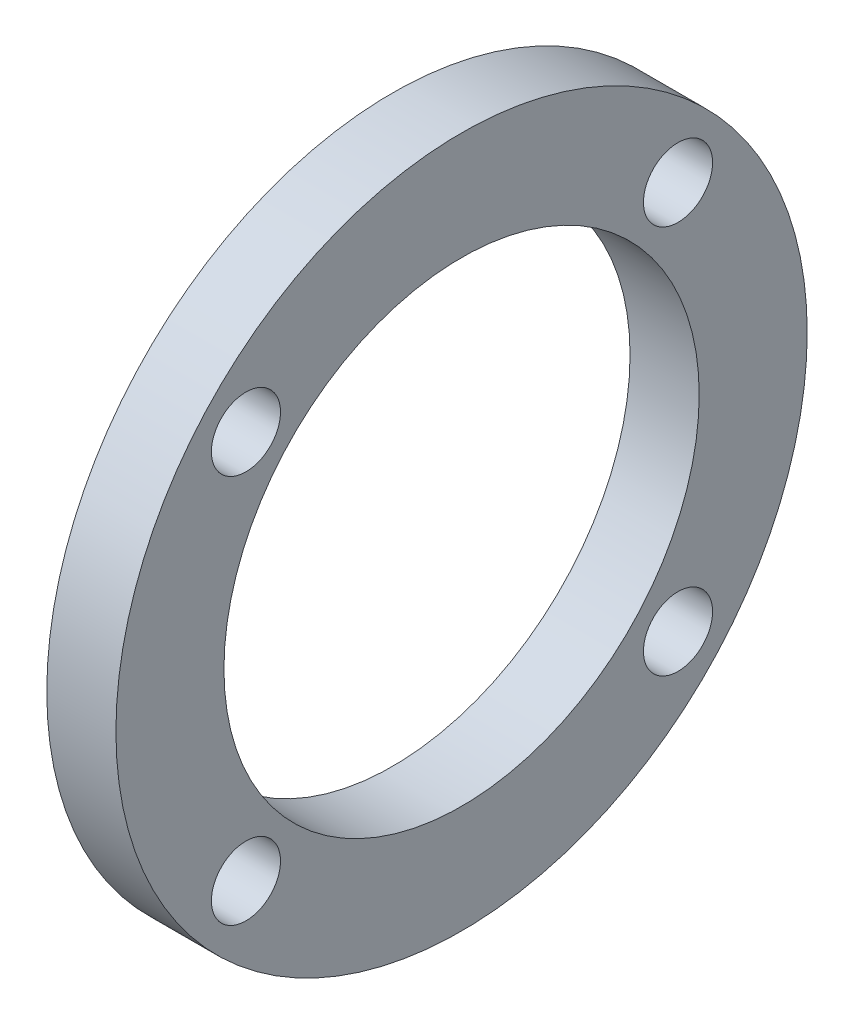
from build123d import *

# Parameters (mm, degrees)
SKETCH1_R           = 40
BOSS_EXTRUDE1_DEPTH = 8
SKETCH3_R           = 4
SKETCH3_R_2         = 4.000000002
CUT_EXTRUDE1_DEPTH  = 8
SKETCH4_R           = 27.5
CUT_EXTRUDE2_DEPTH  = 8


with BuildPart() as part:
    # Sketch1 → Boss-Extrude1 (new body)
    with BuildSketch(Plane(origin=(0, 0, 0), x_dir=(0, 0, -1), z_dir=(1, 0, 0))):
        Circle(SKETCH1_R)
    extrude(amount=BOSS_EXTRUDE1_DEPTH)

    # Sketch3 → Cut-Extrude1 (cut)
    with BuildSketch(Plane(origin=(8, 0, 0), x_dir=(0, 0, -1), z_dir=(1, 0, 0))):
        with Locations((-24.95415797, 22.5)):
            Circle(SKETCH3_R)
        with Locations((25.04584203, 22.500000005)):
            Circle(SKETCH3_R_2)
        with Locations((-24.95415797, -22.5)):
            Circle(SKETCH3_R)
        with Locations((25.04584203, -22.500000005)):
            Circle(SKETCH3_R_2)
    extrude(amount=-CUT_EXTRUDE1_DEPTH, mode=Mode.SUBTRACT)

    # Sketch4 → Cut-Extrude2 (cut)
    with BuildSketch(Plane(origin=(8, 0, 0), x_dir=(0, 0, -1), z_dir=(1, 0, 0))):
        Circle(SKETCH4_R)
    extrude(amount=-CUT_EXTRUDE2_DEPTH, mode=Mode.SUBTRACT)


solid = part.part
